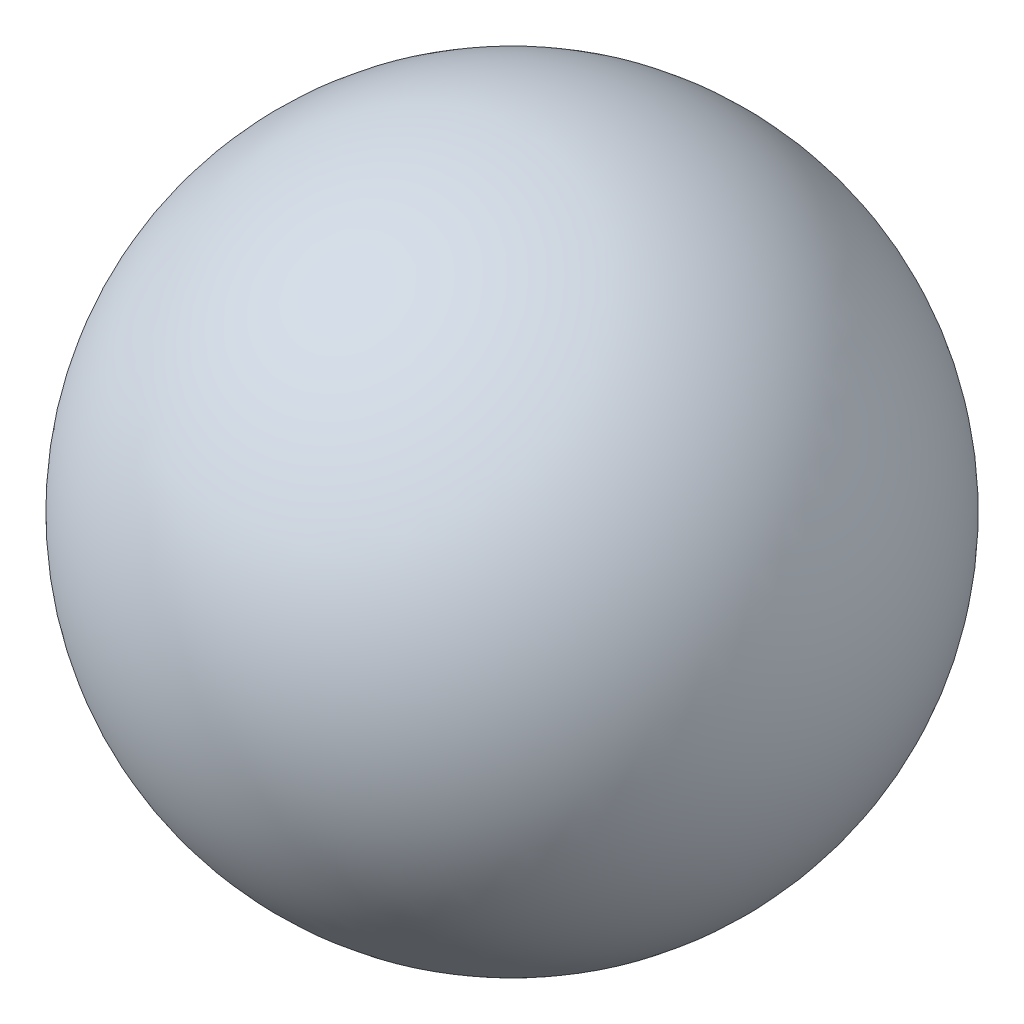
from build123d import *


with BuildPart() as part:
    # Esquisse1 → Révolution1 (revolve)
    with BuildSketch(Plane.XY):
        with BuildLine():
            Line((0, 11), (0, -11))
            ThreePointArc((0, -11), (11, 0), (0, 11))
        make_face()
    revolve(axis=Axis((0, 11, 0), (0, -1, 0)))


solid = part.part
